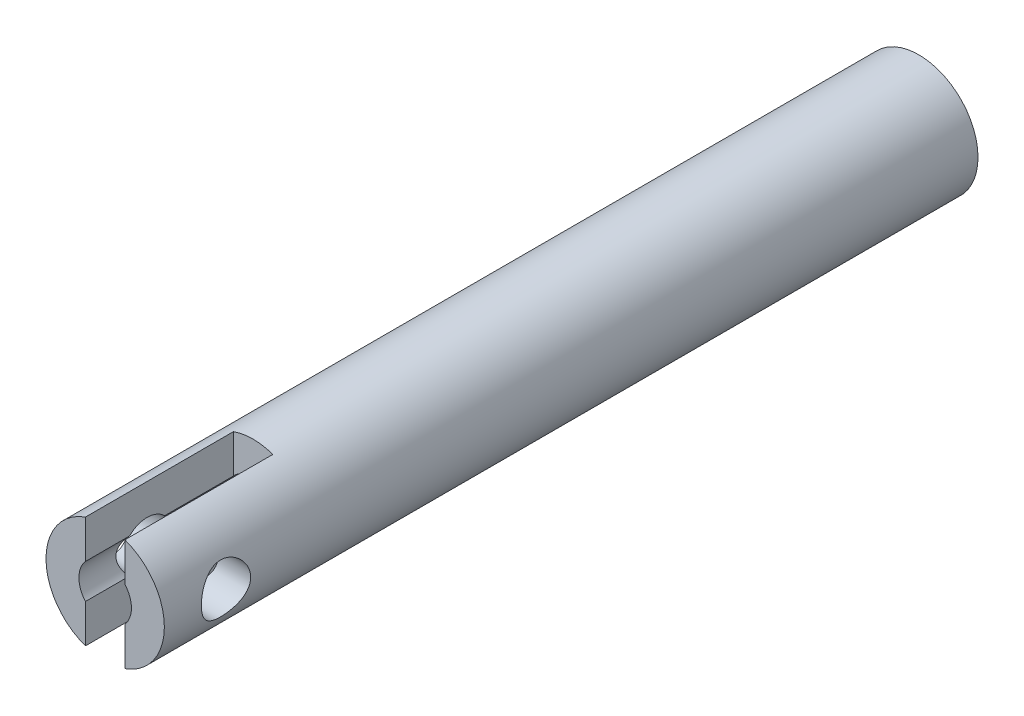
from build123d import *

# Parameters (mm, degrees)
SKETCH1_R               = 3.048
BOSS_EXTRUDE1_DEPTH     = 41.91
CUT_EXTRUDE1_START      = -7.62
CUT_EXTRUDE1_DEPTH      = 7.62
CUT_EXTRUDE2_DEPTH      = 43.216756152
CUT_EXTRUDE2_DEPTH_BACK = 43.216756152
SKETCH3_R               = 1.27
F_6_32_TAPPED_HOLE1_D   = 2.7051


with BuildPart() as part:
    # Sketch1 → Boss-Extrude1 (new body)
    with BuildSketch(Plane.XY):
        Circle(SKETCH1_R)
    extrude(amount=BOSS_EXTRUDE1_DEPTH)

    # Sketch2 → Cut-Extrude1 (cut)
    with BuildSketch(Plane.XY.offset(41.91).offset(CUT_EXTRUDE1_START)):
        with BuildLine():
            ThreePointArc((1.016, 2.873681959), (0.515422831, 3.00410441), (0, 3.048))
            ThreePointArc((0, 3.048), (-0.515422831, 3.00410441), (-1.016, 2.873681959))
            Line((-1.016, 2.873681959), (-1.016, -2.873681959))
            ThreePointArc((-1.016, -2.873681959), (-0.515422831, -3.00410441), (0, -3.048))
            ThreePointArc((0, -3.048), (0.515422831, -3.00410441), (1.016, -2.873681959))
            Line((1.016, -2.873681959), (1.016, 2.873681959))
        make_face()
    extrude(amount=CUT_EXTRUDE1_DEPTH, mode=Mode.SUBTRACT)

    # Sketch3 → Cut-Extrude2 (cut, two sides: drawn at the far end of the back side and taken through both)
    with BuildSketch(Plane(origin=(-1.016, 0, 0), x_dir=(0, 0, -1), z_dir=(1, 0, 0)).offset(-CUT_EXTRUDE2_DEPTH_BACK)):
        with Locations((-38.735, 0)):
            Circle(SKETCH3_R)
    extrude(amount=CUT_EXTRUDE2_DEPTH + CUT_EXTRUDE2_DEPTH_BACK, mode=Mode.SUBTRACT)

    # #6-32 Tapped Hole1 (through all)
    with Locations(Plane(origin=(0, 0, 0), x_dir=(-1, 0, 0), z_dir=(0, 0, -1))):
        with Locations((0, 0), (6.460869533, -0.946768866)):
            Hole(F_6_32_TAPPED_HOLE1_D / 2)


solid = part.part
